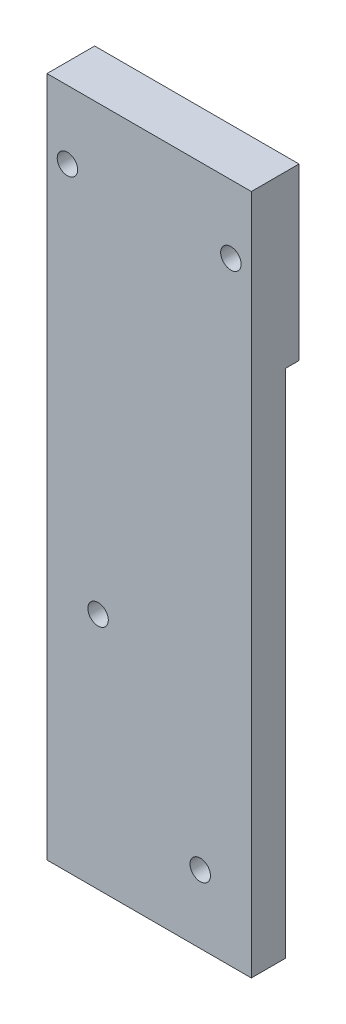
from build123d import *

# Parameters (mm, degrees)
SALIENTE_EXTRUIR1_START = 2
SALIENTE_EXTRUIR1_DEPTH = 5
CROQUIS2_W              = 30
CROQUIS2_H              = 25
SALIENTE_EXTRUIR2_DEPTH = 2
CROQUIS3_R              = 1.5
CORTAR_EXTRUIR1_DEPTH   = 10
CROQUIS4_R              = 1.500036904
CROQUIS4_R_2            = 1.5
CORTAR_EXTRUIR2_DEPTH   = 10


with BuildPart() as part:
    # Croquis1 → Saliente-Extruir1 (new body)
    with BuildSketch(Plane.XY.offset(SALIENTE_EXTRUIR1_START)):
        Polygon((65.454041039, -1015), (65.454041039, -1005), (95.454041039, -1005), (95.454041039, -1015), (95.454041039, -1105), (65.454041039, -1105), align=None)
    extrude(amount=SALIENTE_EXTRUIR1_DEPTH)

    # Croquis2 → Saliente-Extruir2 (add)
    with BuildSketch(Plane(origin=(0, 0, 2), x_dir=(-1, 0, 0), z_dir=(0, 0, -1))):
        with Locations((-80.454041039, -1017.5)):
            Rectangle(CROQUIS2_W, CROQUIS2_H)
    extrude(amount=SALIENTE_EXTRUIR2_DEPTH)

    # Croquis3 → Cortar-Extruir1 (cut)
    with BuildSketch(Plane(origin=(0, 0, 2), x_dir=(-1, 0, 0), z_dir=(0, 0, -1))):
        with Locations((-72.954041039, -1070)):
            Circle(CROQUIS3_R)
        with Locations((-87.954041039, -1095)):
            Circle(CROQUIS3_R)
    extrude(amount=-CORTAR_EXTRUIR1_DEPTH, mode=Mode.SUBTRACT)

    # Croquis4 → Cortar-Extruir2 (cut)
    with BuildSketch(Plane(origin=(0, 0, 0), x_dir=(-1, 0, 0), z_dir=(0, 0, -1))):
        with Locations((-92.454041038, -1014.999963096)):
            Circle(CROQUIS4_R)
        with Locations((-68.454041039, -1015)):
            Circle(CROQUIS4_R_2)
    extrude(amount=-CORTAR_EXTRUIR2_DEPTH, mode=Mode.SUBTRACT)


solid = part.part
